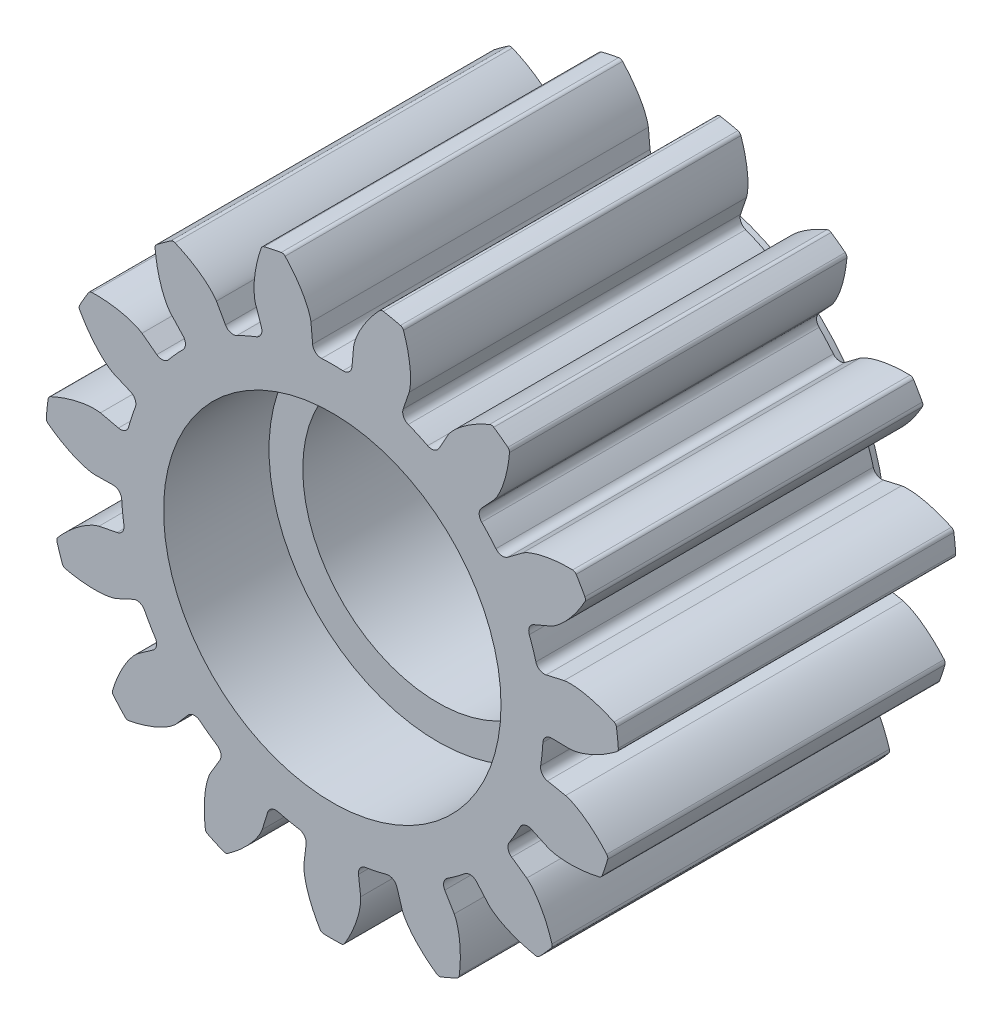
from build123d import *

# Parameters (mm, degrees)
SKETCH1_R                            = 10.795
BOSS_EXTRUDE1_DEPTH                  = 12.7
CUT_EXTRUDE_DCLTBC_DEPTH             = 20.858349629
FILLET_DCLTBC_R                      = 0.16191473
CIRPATTERN_DCLTBC_COUNT              = 15
FILLET_DCLTBC_OF_CIRPATTERN_DCLTBC_R = 0.16191473
SKETCH4_R                            = 4.7625
CUT_EXTRUDE2_DEPTH                   = 20.842433323
SKETCH5_R                            = 6.35
CUT_EXTRUDE3_DEPTH                   = 3.96875
SKETCH6_R                            = 5.08
CUT_EXTRUDE4_DEPTH                   = 18.568918178
SKETCH7_R                            = 7.874
SKETCH7_R_2                          = 5.08
BOSS_EXTRUDE2_DEPTH                  = 0.254


with BuildPart() as part:
    # Sketch1 → Boss-Extrude1 (new body)
    with BuildSketch(Plane.XY):
        Circle(SKETCH1_R)
    extrude(amount=BOSS_EXTRUDE1_DEPTH)

    # DCLTBC → Cut-Extrude-DCLTBC (cut, through all)
    with BuildSketch(Plane.XY):
        with BuildLine():
            Line((-0.802818587, 8.914495233), (-0.740427698, 8.221706986))
            ThreePointArc((-0.740427698, 8.221706986), (-0.630257432, 8.006271015), (-0.401522418, 7.927337888))
            ThreePointArc((-0.401522418, 7.927337888), (0, 7.9375), (0.401522418, 7.927337888))
            ThreePointArc((0.401522418, 7.927337888), (0.630257432, 8.006271015), (0.740427698, 8.221706986))
            Line((0.740427698, 8.221706986), (0.802818587, 8.914495233))
            add(Edge.make_bspline(
                [(0.802818587, 8.914495233), (0.803131142, 8.917487435), (0.804139953, 8.925865852), (0.80656879, 8.941647636), (0.811270729, 8.967299615), (0.818345273, 8.999823949), (0.828729071, 9.041652481), (0.842550873, 9.090633409), (0.859399182, 9.144123806), (0.879511081, 9.201922472), (0.901144634, 9.25920993), (0.924178471, 9.315984979), (0.948430292, 9.372191469), (0.979342251, 9.439837066), (1.018538012, 9.520325317), (1.067428746, 9.613428787), (1.12649102, 9.717822762), (1.190507582, 9.822848203), (1.256628492, 9.925038984), (1.326987451, 10.026879137), (1.397578623, 10.124409808), (1.474483108, 10.224171387), (1.547297108, 10.315478376), (1.632781141, 10.415976739), (1.70291362, 10.496562188), (1.778576412, 10.578247549), (1.815874408, 10.617771444), (1.835134193, 10.63787138)],
                knots=[0, 0, 0, 0, 0, 0.005376749, 0.015083688, 0.02853182, 0.04661014, 0.064854849, 0.092110525, 0.119476176, 0.146842496, 0.174208854, 0.201574956, 0.228941013, 0.256307345, 0.307035032, 0.361767352, 0.416499661, 0.471231937, 0.525964282, 0.580696616, 0.635428982, 0.690161387, 0.744893688, 0.799626082, 0.854358408, 0.909090915, 0.909090915, 0.909090915, 0.909090915, 0.909090915], degree=4))
            ThreePointArc((1.835134193, 10.63787138), (0, 10.795), (-1.835134193, 10.63787138))
            add(Edge.make_bspline(
                [(-0.802818587, 8.914495233), (-0.803131142, 8.917487435), (-0.804139953, 8.925865852), (-0.80656879, 8.941647636), (-0.811270729, 8.967299615), (-0.818345273, 8.999823949), (-0.828729071, 9.041652481), (-0.842550873, 9.090633409), (-0.859399182, 9.144123806), (-0.879511081, 9.201922472), (-0.901144634, 9.25920993), (-0.924178471, 9.315984979), (-0.948430292, 9.372191469), (-0.979342251, 9.439837066), (-1.018538012, 9.520325317), (-1.067428746, 9.613428787), (-1.12649102, 9.717822762), (-1.190507582, 9.822848203), (-1.256628492, 9.925038984), (-1.326987451, 10.026879137), (-1.397578623, 10.124409808), (-1.474483108, 10.224171387), (-1.547297108, 10.315478376), (-1.632781141, 10.415976739), (-1.70291362, 10.496562188), (-1.778576412, 10.578247549), (-1.815874408, 10.617771444), (-1.835134193, 10.63787138)],
                knots=[0, 0, 0, 0, 0, 0.005376749, 0.015083688, 0.02853182, 0.04661014, 0.064854849, 0.092110525, 0.119476176, 0.146842496, 0.174208854, 0.201574956, 0.228941013, 0.256307345, 0.307035032, 0.361767352, 0.416499661, 0.471231937, 0.525964282, 0.580696616, 0.635428982, 0.690161387, 0.744893688, 0.799626082, 0.854358408, 0.909090915, 0.909090915, 0.909090915, 0.909090915, 0.909090915], degree=4))
        make_face()
    cut_extrude_dcltbc = extrude(amount=CUT_EXTRUDE_DCLTBC_DEPTH, mode=Mode.SUBTRACT)

    # Fillet-DCLTBC
    fillet_dcltbc_edges = [part.edges().sort_by_distance(p)[0] for p in [
        (1.835134193, 10.63787138, 6.35),
        (-1.835134193, 10.63787138, 6.35),
    ]]
    fillet(fillet_dcltbc_edges, radius=FILLET_DCLTBC_R)

    # CirPattern-DCLTBC: Cut-Extrude-DCLTBC ×15 about axis
    cirpattern_dcltbc_axis = Axis((0, 0, 12.7), (0, 0, 1))
    for i in range(1, CIRPATTERN_DCLTBC_COUNT):
        add(cut_extrude_dcltbc.rotate(cirpattern_dcltbc_axis, i * 360 / CIRPATTERN_DCLTBC_COUNT), mode=Mode.SUBTRACT)

    # Fillet-DCLTBC of CirPattern-DCLTBC
    fillet_dcltbc_of_cirpattern_dcltbc_edges = [part.edges().sort_by_distance(p)[0] for p in [
        (-2.650333588, 10.464595399, 6.35),
        (-6.003290601, 8.971762757, 6.35),
        (-6.677534615, 8.481895806, 6.35),
        (-9.133423525, 5.754354847, 6.35),
        (-9.550129243, 5.032599373, 6.35),
        (-10.684304548, 1.541966708, 6.35),
        (-10.771419764, 0.713120788, 6.35),
        (-10.38777225, -2.937041483, 6.35),
        (-10.130233954, -3.72966286, 6.35),
        (-8.295099761, -6.90820852, 6.35),
        (-7.737438662, -7.527553916, 6.35),
        (-4.768129164, -9.684883545, 6.35),
        (-4.006769933, -10.023862514, 6.35),
        (-0.416705718, -10.78695422, 6.35),
        (0.416705718, -10.78695422, 6.35),
        (4.006769933, -10.023862514, 6.35),
        (4.768129164, -9.684883545, 6.35),
        (7.737438662, -7.527553916, 6.35),
        (8.295099761, -6.90820852, 6.35),
        (10.130233954, -3.72966286, 6.35),
        (10.38777225, -2.937041483, 6.35),
        (10.771419764, 0.713120788, 6.35),
        (10.684304548, 1.541966708, 6.35),
        (9.550129243, 5.032599373, 6.35),
        (9.133423525, 5.754354847, 6.35),
        (6.677534615, 8.481895806, 6.35),
        (6.003290601, 8.971762757, 6.35),
        (2.650333588, 10.464595399, 6.35),
    ]]
    fillet(fillet_dcltbc_of_cirpattern_dcltbc_edges, radius=FILLET_DCLTBC_OF_CIRPATTERN_DCLTBC_R)

    # Sketch4 → Cut-Extrude2 (cut, through all)
    with BuildSketch(Plane.XY.offset(12.7)):
        Circle(SKETCH4_R)
    extrude(amount=-CUT_EXTRUDE2_DEPTH, mode=Mode.SUBTRACT)

    # Sketch5 → Cut-Extrude3 (cut)
    with BuildSketch(Plane.XY.offset(12.7)):
        Circle(SKETCH5_R)
    extrude(amount=-CUT_EXTRUDE3_DEPTH, mode=Mode.SUBTRACT)

    # Sketch6 → Cut-Extrude4 (cut, through all)
    with BuildSketch(Plane.XY.offset(8.73125)):
        Circle(SKETCH6_R)
    extrude(amount=-CUT_EXTRUDE4_DEPTH, mode=Mode.SUBTRACT)

    # Sketch7 → Boss-Extrude2 (add)
    with BuildSketch(Plane(origin=(0, 0, 0), x_dir=(-1, 0, 0), z_dir=(0, 0, -1))):
        with Locations(Location((0, 0, 0), (0, 0, 180))):
            Circle(SKETCH7_R)
        with Locations(Location((0, 0, 0), (0, 0, 180))):
            Circle(SKETCH7_R_2, mode=Mode.SUBTRACT)
    extrude(amount=BOSS_EXTRUDE2_DEPTH)


solid = part.part
